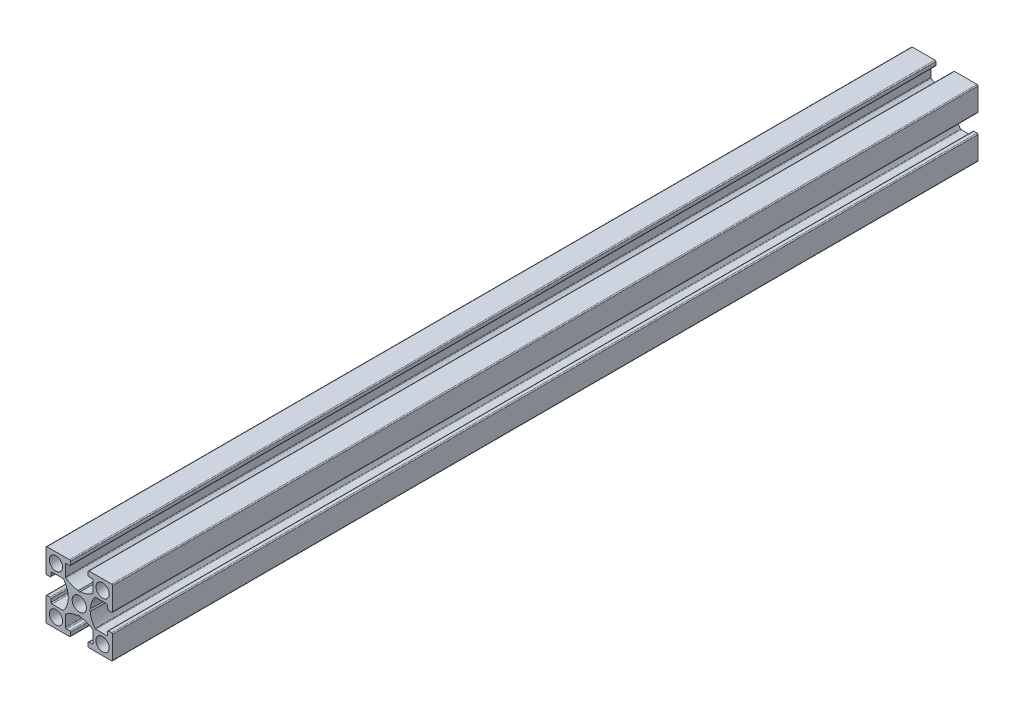
from build123d import *

# Parameters (mm, degrees)
MODEL_R             = 2.15
MODEL_R_2           = 2
EXTRUDE_1_DEPTH     = 260
SKETCH_1_R          = 2.5
CUT_EXTRUDE_1_DEPTH = 1025.78575674
SKETCH_3_R          = 2.5
CUT_EXTRUDE_3_DEPTH = 1077.739299669


with BuildPart() as part:
    # Model → 보스-돌출1 (new body)
    with BuildSketch(Plane.XY):
        with BuildLine():
            Line((2307.763927197, 1192.134297913), (2307.763927197, 1195.391548465))
            ThreePointArc((2307.763927197, 1195.391548465), (2307.676059232, 1195.603680499), (2307.463927197, 1195.691548465))
            Line((2307.463927197, 1195.691548465), (2306.563927197, 1195.691548465))
            ThreePointArc((2306.563927197, 1195.691548465), (2306.351795163, 1195.779416431), (2306.263927197, 1195.991548465))
            Line((2306.263927197, 1195.991548465), (2306.263927197, 1196.891548465))
            ThreePointArc((2306.263927197, 1196.891548465), (2306.351795163, 1197.103680499), (2306.563927197, 1197.191548465))
            Line((2306.563927197, 1197.191548465), (2313.313927197, 1197.191548465))
            ThreePointArc((2313.313927197, 1197.191548465), (2313.526059232, 1197.103680499), (2313.613927197, 1196.891548465))
            Line((2313.613927197, 1196.891548465), (2313.613927197, 1190.141548465))
            ThreePointArc((2313.613927197, 1190.141548465), (2313.526059232, 1189.929416431), (2313.313927197, 1189.841548465))
            Line((2313.313927197, 1189.841548465), (2312.413927197, 1189.841548465))
            ThreePointArc((2312.413927197, 1189.841548465), (2312.201795163, 1189.929416431), (2312.113927197, 1190.141548465))
            Line((2312.113927197, 1190.141548465), (2312.113927197, 1191.041548465))
            ThreePointArc((2312.113927197, 1191.041548465), (2312.026059232, 1191.253680499), (2311.813927197, 1191.341548465))
            Line((2311.813927197, 1191.341548465), (2308.556676645, 1191.341548465))
            ThreePointArc((2308.556676645, 1191.341548465), (2308.426234796, 1191.311705686), (2308.321744595, 1191.228114625))
            ThreePointArc((2308.321744595, 1191.228114625), (2307.328306374, 1189.47356999), (2306.921204563, 1187.498825831))
            Line((2306.921204563, 1187.498825831), (2306.613927197, 1187.191548465))
            Line((2306.613927197, 1187.191548465), (2306.921204563, 1186.884271099))
            ThreePointArc((2306.921204563, 1186.884271099), (2307.328306374, 1184.90952694), (2308.321744595, 1183.154982305))
            ThreePointArc((2308.321744595, 1183.154982305), (2308.426234796, 1183.071391244), (2308.556676645, 1183.041548465))
            Line((2308.556676645, 1183.041548465), (2311.813927197, 1183.041548465))
            ThreePointArc((2311.813927197, 1183.041548465), (2312.026059232, 1183.129416431), (2312.113927197, 1183.341548465))
            Line((2312.113927197, 1183.341548465), (2312.113927197, 1184.241548465))
            ThreePointArc((2312.113927197, 1184.241548465), (2312.201795163, 1184.453680499), (2312.413927197, 1184.541548465))
            Line((2312.413927197, 1184.541548465), (2313.313927197, 1184.541548465))
            ThreePointArc((2313.313927197, 1184.541548465), (2313.526059232, 1184.453680499), (2313.613927197, 1184.241548465))
            Line((2313.613927197, 1184.241548465), (2313.613927197, 1177.491548465))
            ThreePointArc((2313.613927197, 1177.491548465), (2313.526059232, 1177.279416431), (2313.313927197, 1177.191548465))
            Line((2313.313927197, 1177.191548465), (2306.563927197, 1177.191548465))
            ThreePointArc((2306.563927197, 1177.191548465), (2306.351795163, 1177.279416431), (2306.263927197, 1177.491548465))
            Line((2306.263927197, 1177.491548465), (2306.263927197, 1178.391548465))
            ThreePointArc((2306.263927197, 1178.391548465), (2306.351795163, 1178.603680499), (2306.563927197, 1178.691548465))
            Line((2306.563927197, 1178.691548465), (2307.463927197, 1178.691548465))
            ThreePointArc((2307.463927197, 1178.691548465), (2307.676059232, 1178.779416431), (2307.763927197, 1178.991548465))
            Line((2307.763927197, 1178.991548465), (2307.763927197, 1182.248799017))
            ThreePointArc((2307.763927197, 1182.248799017), (2307.734084418, 1182.379240866), (2307.650493357, 1182.483731067))
            ThreePointArc((2307.650493357, 1182.483731067), (2305.895948722, 1183.477169289), (2303.921204563, 1183.884271099))
            Line((2303.921204563, 1183.884271099), (2303.613927197, 1184.191548465))
            Line((2303.613927197, 1184.191548465), (2303.306649831, 1183.884271099))
            ThreePointArc((2303.306649831, 1183.884271099), (2301.331905673, 1183.477169289), (2299.577361038, 1182.483731067))
            ThreePointArc((2299.577361038, 1182.483731067), (2299.493769977, 1182.379240866), (2299.463927197, 1182.248799017))
            Line((2299.463927197, 1182.248799017), (2299.463927197, 1178.991548465))
            ThreePointArc((2299.463927197, 1178.991548465), (2299.551795163, 1178.779416431), (2299.763927197, 1178.691548465))
            Line((2299.763927197, 1178.691548465), (2300.663927197, 1178.691548465))
            ThreePointArc((2300.663927197, 1178.691548465), (2300.876059232, 1178.603680499), (2300.963927197, 1178.391548465))
            Line((2300.963927197, 1178.391548465), (2300.963927197, 1177.491548465))
            ThreePointArc((2300.963927197, 1177.491548465), (2300.876059232, 1177.279416431), (2300.663927197, 1177.191548465))
            Line((2300.663927197, 1177.191548465), (2293.913927197, 1177.191548465))
            ThreePointArc((2293.913927197, 1177.191548465), (2293.701795163, 1177.279416431), (2293.613927197, 1177.491548465))
            Line((2293.613927197, 1177.491548465), (2293.613927197, 1184.241548465))
            ThreePointArc((2293.613927197, 1184.241548465), (2293.701795163, 1184.453680499), (2293.913927197, 1184.541548465))
            Line((2293.913927197, 1184.541548465), (2294.813927197, 1184.541548465))
            ThreePointArc((2294.813927197, 1184.541548465), (2295.026059232, 1184.453680499), (2295.113927197, 1184.241548465))
            Line((2295.113927197, 1184.241548465), (2295.113927197, 1183.341548465))
            ThreePointArc((2295.113927197, 1183.341548465), (2295.201795163, 1183.129416431), (2295.413927197, 1183.041548465))
            Line((2295.413927197, 1183.041548465), (2298.671177749, 1183.041548465))
            ThreePointArc((2298.671177749, 1183.041548465), (2298.801619599, 1183.071391244), (2298.906109799, 1183.154982305))
            ThreePointArc((2298.906109799, 1183.154982305), (2299.899548021, 1184.90952694), (2300.306649831, 1186.884271099))
            Line((2300.306649831, 1186.884271099), (2300.613927197, 1187.191548465))
            Line((2300.613927197, 1187.191548465), (2300.306649831, 1187.498825831))
            ThreePointArc((2300.306649831, 1187.498825831), (2299.899548021, 1189.47356999), (2298.906109799, 1191.228114625))
            ThreePointArc((2298.906109799, 1191.228114625), (2298.801619599, 1191.311705686), (2298.671177749, 1191.341548465))
            Line((2298.671177749, 1191.341548465), (2295.413927197, 1191.341548465))
            ThreePointArc((2295.413927197, 1191.341548465), (2295.201795163, 1191.253680499), (2295.113927197, 1191.041548465))
            Line((2295.113927197, 1191.041548465), (2295.113927197, 1190.141548465))
            ThreePointArc((2295.113927197, 1190.141548465), (2295.026059232, 1189.929416431), (2294.813927197, 1189.841548465))
            Line((2294.813927197, 1189.841548465), (2293.913927197, 1189.841548465))
            ThreePointArc((2293.913927197, 1189.841548465), (2293.701795163, 1189.929416431), (2293.613927197, 1190.141548465))
            Line((2293.613927197, 1190.141548465), (2293.613927197, 1196.891548465))
            ThreePointArc((2293.613927197, 1196.891548465), (2293.701795163, 1197.103680499), (2293.913927197, 1197.191548465))
            Line((2293.913927197, 1197.191548465), (2300.663927197, 1197.191548465))
            ThreePointArc((2300.663927197, 1197.191548465), (2300.876059232, 1197.103680499), (2300.963927197, 1196.891548465))
            Line((2300.963927197, 1196.891548465), (2300.963927197, 1195.991548465))
            ThreePointArc((2300.963927197, 1195.991548465), (2300.876059232, 1195.779416431), (2300.663927197, 1195.691548465))
            Line((2300.663927197, 1195.691548465), (2299.763927197, 1195.691548465))
            ThreePointArc((2299.763927197, 1195.691548465), (2299.551795163, 1195.603680499), (2299.463927197, 1195.391548465))
            Line((2299.463927197, 1195.391548465), (2299.463927197, 1192.134297913))
            ThreePointArc((2299.463927197, 1192.134297913), (2299.493769977, 1192.003856063), (2299.577361038, 1191.899365863))
            ThreePointArc((2299.577361038, 1191.899365863), (2301.331905673, 1190.905927641), (2303.306649831, 1190.498825831))
            Line((2303.306649831, 1190.498825831), (2303.613927197, 1190.191548465))
            Line((2303.613927197, 1190.191548465), (2303.921204563, 1190.498825831))
            ThreePointArc((2303.921204563, 1190.498825831), (2305.895948722, 1190.905927641), (2307.650493357, 1191.899365863))
            ThreePointArc((2307.650493357, 1191.899365863), (2307.734084418, 1192.003856063), (2307.763927197, 1192.134297913))
        make_face()
        with Locations((2303.613927197, 1187.191548465)):
            Circle(MODEL_R, mode=Mode.SUBTRACT)
        with Locations((2296.613927197, 1194.191548465)):
            Circle(MODEL_R_2, mode=Mode.SUBTRACT)
        with Locations((2296.613927197, 1180.191548465)):
            Circle(MODEL_R_2, mode=Mode.SUBTRACT)
        with Locations((2310.613927197, 1194.191548465)):
            Circle(MODEL_R_2, mode=Mode.SUBTRACT)
        with Locations((2310.613927197, 1180.191548465)):
            Circle(MODEL_R_2, mode=Mode.SUBTRACT)
    extrude(amount=EXTRUDE_1_DEPTH)

    # 스케치1 → 컷-돌출1 (cut, through all)
    with BuildSketch(Plane(origin=(2294.587744385, 1173.191548465, -764.328), x_dir=(0, 0, 1), z_dir=(0, -1, 0))):
        with Locations(Location((864.328, -9.026182812, 0), (0, 0, 180))):
            Circle(SKETCH_1_R)
        with Locations(Location((814.328, -9.026182812, 0), (0, 0, 180))):
            Circle(SKETCH_1_R)
        with Locations(Location((934.328, -9.026182812, 0), (0, 0, 180))):
            Circle(SKETCH_1_R)
    extrude(amount=-CUT_EXTRUDE_1_DEPTH, mode=Mode.SUBTRACT)

    # 스케치3 → 컷-돌출3 (cut, through all)
    with BuildSketch(Plane(origin=(1982.64011001, 1173.191548465, 1024.328), x_dir=(0, 0, -1), z_dir=(0, -1, 0))):
        with Locations((864.328, 320.973817188)):
            Circle(SKETCH_3_R)
        with Locations((814.328, 320.973817188)):
            Circle(SKETCH_3_R)
        with Locations((934.328, 320.973817188)):
            Circle(SKETCH_3_R)
    extrude(amount=-CUT_EXTRUDE_3_DEPTH, mode=Mode.SUBTRACT)


solid = part.part
